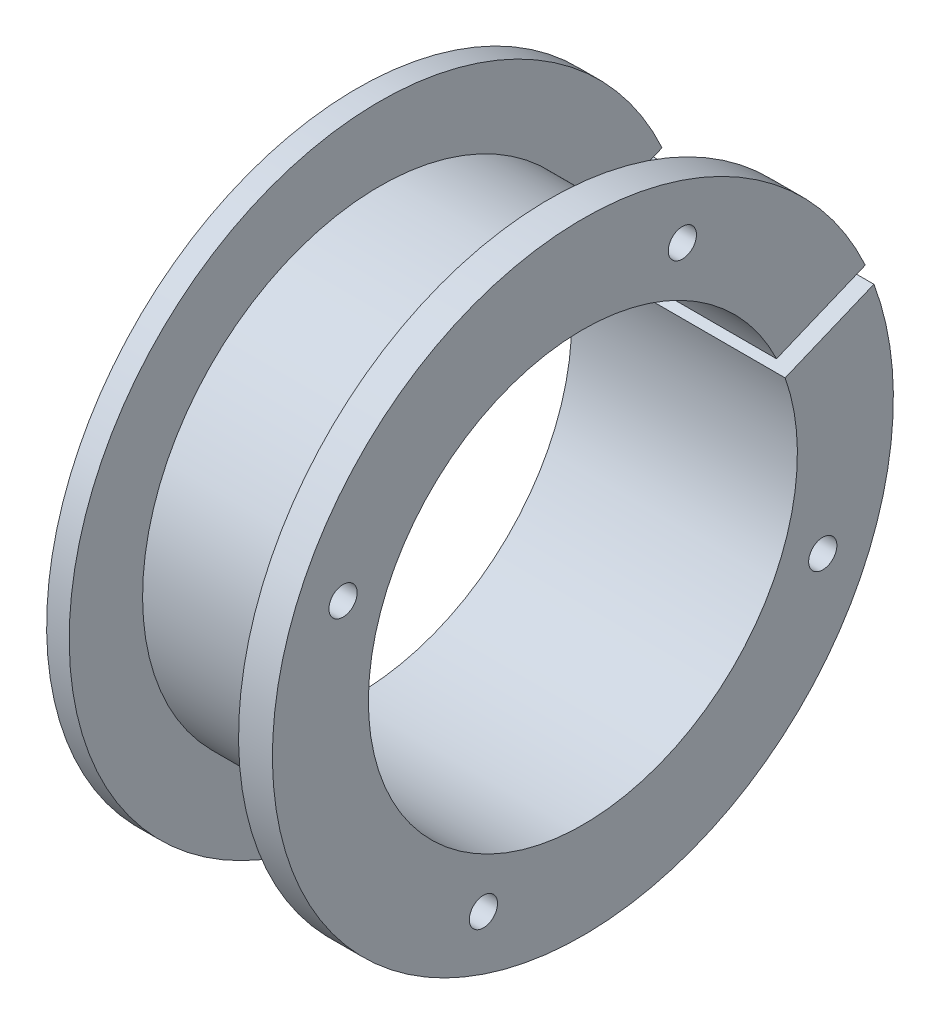
from build123d import *

# Parameters (mm, degrees)
M3X0_5_TAPPED_HOLE1_D     = 2.5
M3X0_5_TAPPED_HOLE1_DEPTH = 7.5
M3X0_5_TAPPED_HOLE1_TIP   = 0.751075774
CUT_EXTRUDE1_DEPTH        = 44.732139211


with BuildPart() as part:
    # Sketch1 → Revolve1 (revolve)
    with BuildSketch(Plane.XY, mode=Mode.PRIVATE) as revolve1_sk:
        Polygon((0, 19), (-20, 19), (-20, 27.5), (-18, 27.5), (-18, 21), (-3, 21), (-3, 27.5), (0, 27.5), align=None)
    revolve(revolve1_sk.sketch.rotate(Axis((0, 0, 0), (-1, 0, 0)), 90), axis=Axis((0, 0, 0), (-1, 0, 0)))

    # M3x0.5 Tapped Hole1
    with Locations(Plane(origin=(0, 0, 0), x_dir=(0, 0, -1), z_dir=(1, 0, 0))):
        with Locations((-8.810127185, -21.245744491), (21.245744491, -8.810127185), (8.810127185, 21.245744491), (-21.245744491, 8.810127185)):
            Hole(M3X0_5_TAPPED_HOLE1_D / 2, depth=M3X0_5_TAPPED_HOLE1_DEPTH)
            with Locations((0, 0, -(M3X0_5_TAPPED_HOLE1_DEPTH + M3X0_5_TAPPED_HOLE1_TIP / 2))):  # 118° drill point
                Cone(0, M3X0_5_TAPPED_HOLE1_D / 2, M3X0_5_TAPPED_HOLE1_TIP, mode=Mode.SUBTRACT)

    # Sketch4 → Cut-Extrude1 (cut, through all)
    with BuildSketch(Plane.ZY.offset(20)):
        Polygon((-25.793167519, 9.589708511), (-25.028531926, 11.437770309), (-17.149935818, 8.178001065), (-17.914571412, 6.329939267), align=None)
    extrude(amount=-CUT_EXTRUDE1_DEPTH, mode=Mode.SUBTRACT)


solid = part.part
